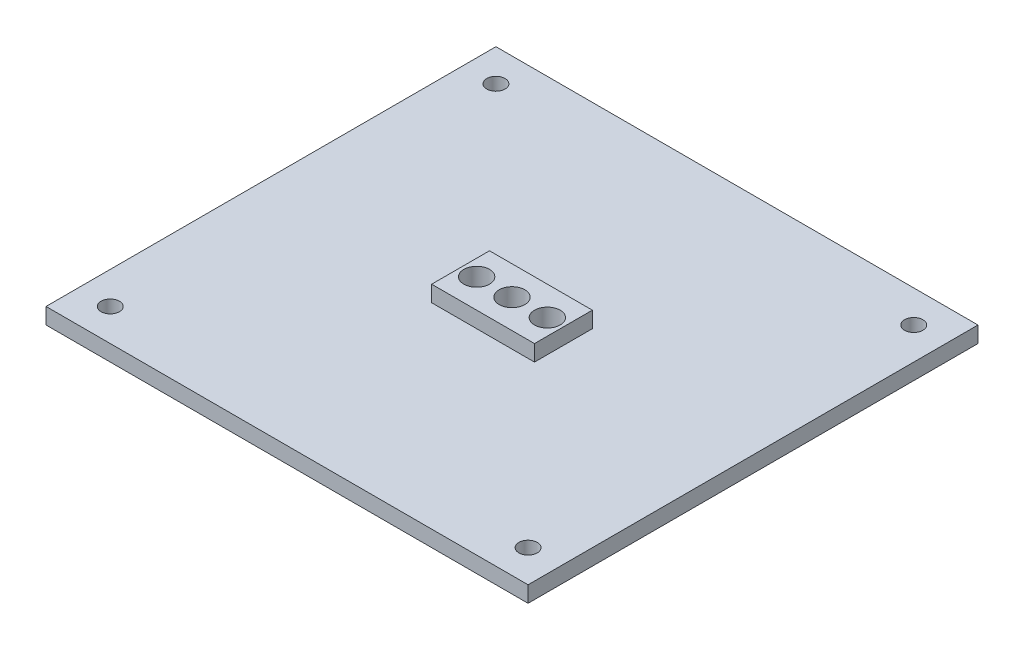
from build123d import *

# Parameters (mm, degrees)
SKETCH1_W           = 150
SKETCH1_H           = 140
SKETCH1_R           = 2.85
SKETCH1_R_2         = 4
BOSS_EXTRUDE1_DEPTH = 5
SKETCH2_W           = 32
SKETCH2_H           = 18
SKETCH2_R           = 4
BOSS_EXTRUDE2_DEPTH = 5


with BuildPart() as part:
    # Sketch1 → Boss-Extrude1 (new body)
    with BuildSketch(Plane(origin=(0, 0, 0), x_dir=(1, 0, 0), z_dir=(0, 1, 0))):
        with Locations((-0.545997502, 48.457242913)):
            Rectangle(SKETCH1_W, SKETCH1_H)
        with Locations(Location((-65.545997502, 108.457242913, 0), (0, 0, 270))):
            Circle(SKETCH1_R, mode=Mode.SUBTRACT)
        with Locations(Location((64.454002498, 108.457242913, 0), (0, 0, 270))):
            Circle(SKETCH1_R, mode=Mode.SUBTRACT)
        with Locations(Location((64.454002498, -11.542757087, 0), (0, 0, 270))):
            Circle(SKETCH1_R, mode=Mode.SUBTRACT)
        with Locations(Location((-65.545997502, -11.542757087, 0), (0, 0, 270))):
            Circle(SKETCH1_R, mode=Mode.SUBTRACT)
        with Locations(Location((-11.545997502, 48.457242913, 0), (0, 0, 270))):
            Circle(SKETCH1_R_2, mode=Mode.SUBTRACT)
        with Locations(Location((-0.545997502, 48.457242913, 0), (0, 0, 270))):
            Circle(SKETCH1_R_2, mode=Mode.SUBTRACT)
        with Locations(Location((10.454002498, 48.457242913, 0), (0, 0, 270))):
            Circle(SKETCH1_R_2, mode=Mode.SUBTRACT)
    extrude(amount=BOSS_EXTRUDE1_DEPTH)

    # Sketch2 → Boss-Extrude2 (add)
    with BuildSketch(Plane(origin=(0, 5, 0), x_dir=(1, 0, 0), z_dir=(0, 1, 0))):
        with Locations((-0.545997502, 48.457242913)):
            Rectangle(SKETCH2_W, SKETCH2_H)
        with Locations(Location((-0.545997502, 48.457242913, 0), (0, 0, 270))):
            Circle(SKETCH2_R, mode=Mode.SUBTRACT)
        with Locations(Location((10.454002498, 48.457242913, 0), (0, 0, 270))):
            Circle(SKETCH2_R, mode=Mode.SUBTRACT)
        with Locations(Location((-11.545997502, 48.457242913, 0), (0, 0, 270))):
            Circle(SKETCH2_R, mode=Mode.SUBTRACT)
    extrude(amount=BOSS_EXTRUDE2_DEPTH)


solid = part.part
